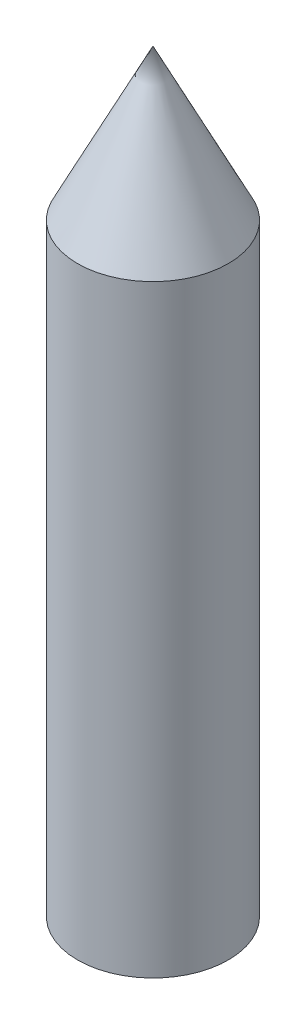
from build123d import *

# Parameters (mm, degrees)
SKETCH1_R           = 6.35
BOSS_EXTRUDE1_DEPTH = 50.8


with BuildPart() as part:
    # Sketch1 → Boss-Extrude1 (new body)
    with BuildSketch(Plane(origin=(0, 0, 0), x_dir=(1, 0, 0), z_dir=(0, 1, 0))):
        Circle(SKETCH1_R)
    extrude(amount=BOSS_EXTRUDE1_DEPTH)

    # Sketch4 → Revolve2 (revolve)
    with BuildSketch(Plane.XY):
        Polygon((0, 50.8), (0, 63.5), (6.35, 50.8), align=None)
    revolve(axis=Axis((0, 50.8, 0), (0, 1, 0)))


solid = part.part
